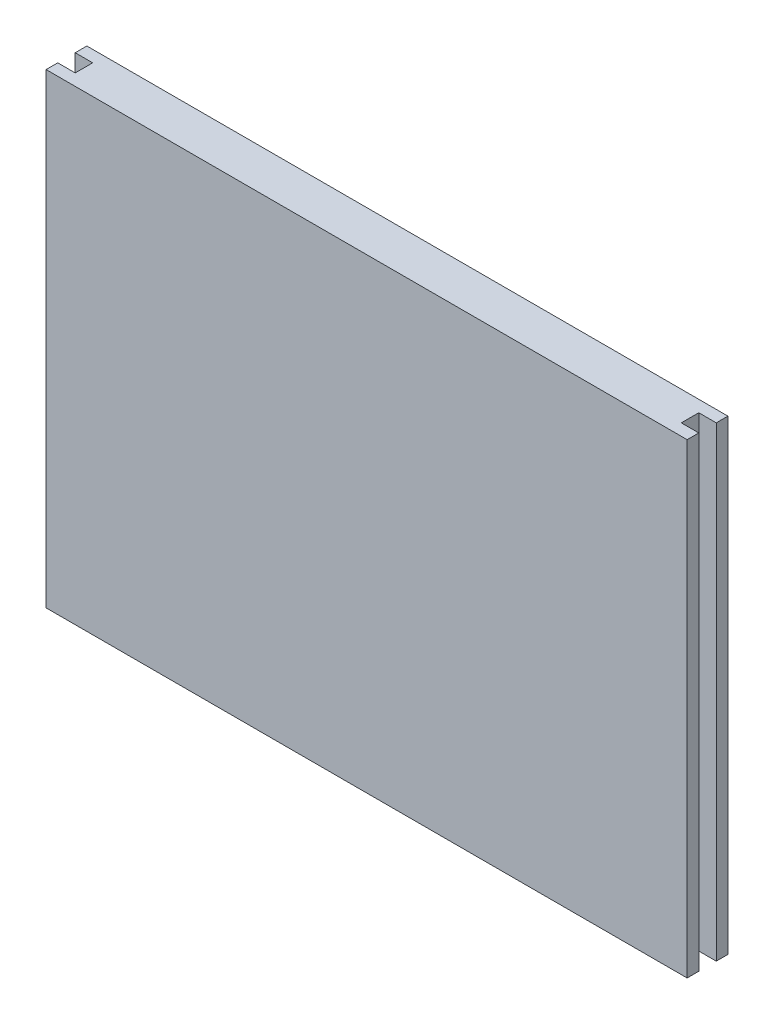
from build123d import *

# Parameters (mm, degrees)
BOSS_EXTRUDE1_DEPTH = 80


with BuildPart() as part:
    # Sketch1 → Boss-Extrude1 (new body)
    with BuildSketch(Plane(origin=(0, 0, 0), x_dir=(1, 0, 0), z_dir=(0, 1, 0))):
        Polygon((0, 0), (-110, 0), (-110, 2), (-107, 2), (-107, 5), (-110, 5), (-110, 7), (0, 7), (0, 5), (-3, 5), (-3, 2), (0, 2), align=None)
    extrude(amount=BOSS_EXTRUDE1_DEPTH)


solid = part.part
